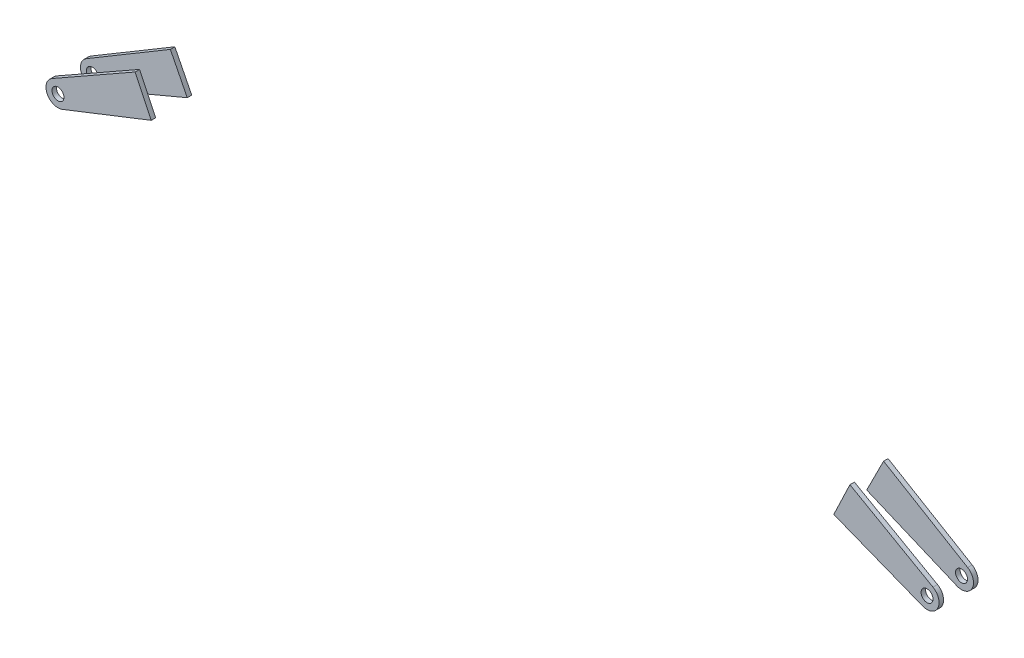
from build123d import *

# Parameters (mm, degrees)
F_3DSKETCH1_R        = 4
BOSS_EXTRUDE_U_DEPTH = 3
BOSS_EXTRUDE_L_START = -3
F_3DSKETCH2_R        = 4
BOSS_EXTRUDE_L_DEPTH = 3


with BuildPart() as part:
    # 3DSketch1 → Boss-Extrude-U (new body)
    with BuildSketch(Plane(origin=(293.950914733, -1963.043688278, 175), x_dir=(-0.9910422724667208, 0.1335485461695409, -2.0318374546162863e-13), z_dir=(0, 0, -1))):
        with BuildLine():
            Line((0, 0), (59.134296826, 23.796048266))
            Line((59.134296826, 23.796048266), (66.799026887, 0))
            Line((66.799026887, 0), (4.893078056, -15.191131412))
            ThreePointArc((4.893078056, -15.191131412), (-4.628217248, -9.874351515), (0, 0))
        make_face()
        with Locations(Location((2.986518198, -7.421637896, 0), (0, 0, 172.32530228))):
            Circle(F_3DSKETCH1_R, mode=Mode.SUBTRACT)
    extrude(amount=-BOSS_EXTRUDE_U_DEPTH)


with BuildPart() as body_2:
    # 3DSketch2 → Boss-Extrude-L (new body)
    with BuildSketch(Plane(origin=(286.896060673, -1977.373300526, 155), x_dir=(-0.7162661408080038, 0.6978272103694504, 1.6259589829986966e-15), z_dir=(0, 0, 1)).offset(BOSS_EXTRUDE_L_START)):
        with BuildLine():
            Line((0, 0), (60.782410485, 23.848885443))
            Line((60.782410485, 23.848885443), (68.281121248, 0))
            Line((68.281121248, 0), (4.787665959, -15.226683706))
            ThreePointArc((4.787665959, -15.226683706), (-4.709600247, -9.846846279), (0, 0))
        make_face()
        with Locations(Location((2.922043094, -7.447258835, 0), (0, 0, 224.252939686))):
            Circle(F_3DSKETCH2_R, mode=Mode.SUBTRACT)
    extrude(amount=BOSS_EXTRUDE_L_DEPTH)


with BuildPart() as body_3:
    # Mirror1: mirrored copy
    add(part.part.mirror(Plane(origin=(0, 0, 0), x_dir=(0, 0, 1), z_dir=(1, 0, 0))))


with BuildPart() as body_4:
    # Mirror1 2: mirrored copy
    add(body_2.part.mirror(Plane(origin=(0, 0, 0), x_dir=(0, 0, 1), z_dir=(1, 0, 0))))


solid = Compound([part.part, body_2.part, body_3.part, body_4.part])
